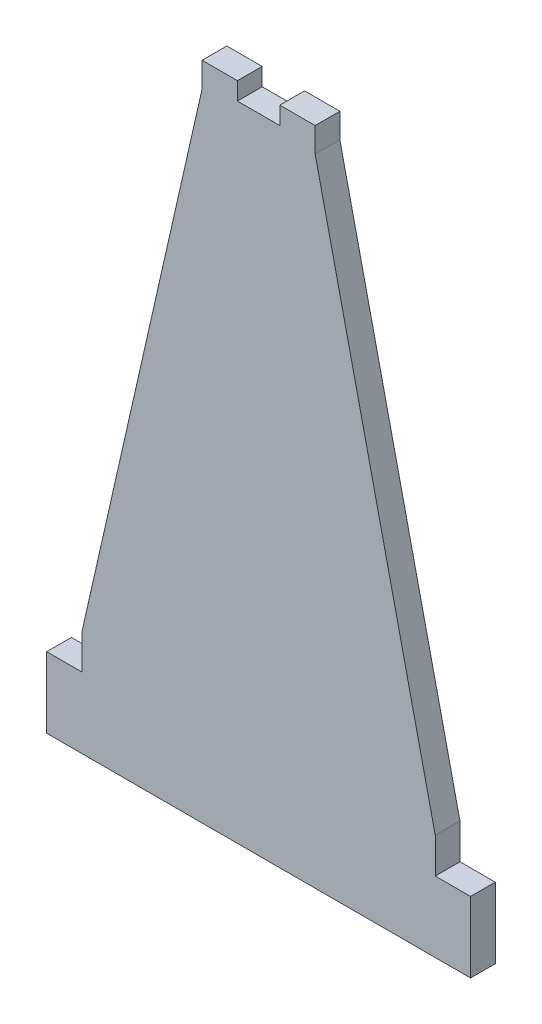
from build123d import *

# Parameters (mm, degrees)
BOSS_EXTRUDE1_DEPTH = 0.175


with BuildPart() as part:
    # frame_outline → Boss-Extrude1 (new, symmetric)
    with BuildSketch(Plane.XY):
        Polygon((0, 0), (6, 0), (6, 1), (5.5, 1), (5.5, 1.5), (3.8, 9), (3.8, 9.35), (3.3, 9.35), (3.3, 9.1), (2.7, 9.1), (2.7, 9.35), (2.2, 9.35), (2.2, 9), (0.5, 1.5), (0.5, 1), (0, 1), align=None)
    extrude(amount=BOSS_EXTRUDE1_DEPTH, both=True)


solid = part.part
